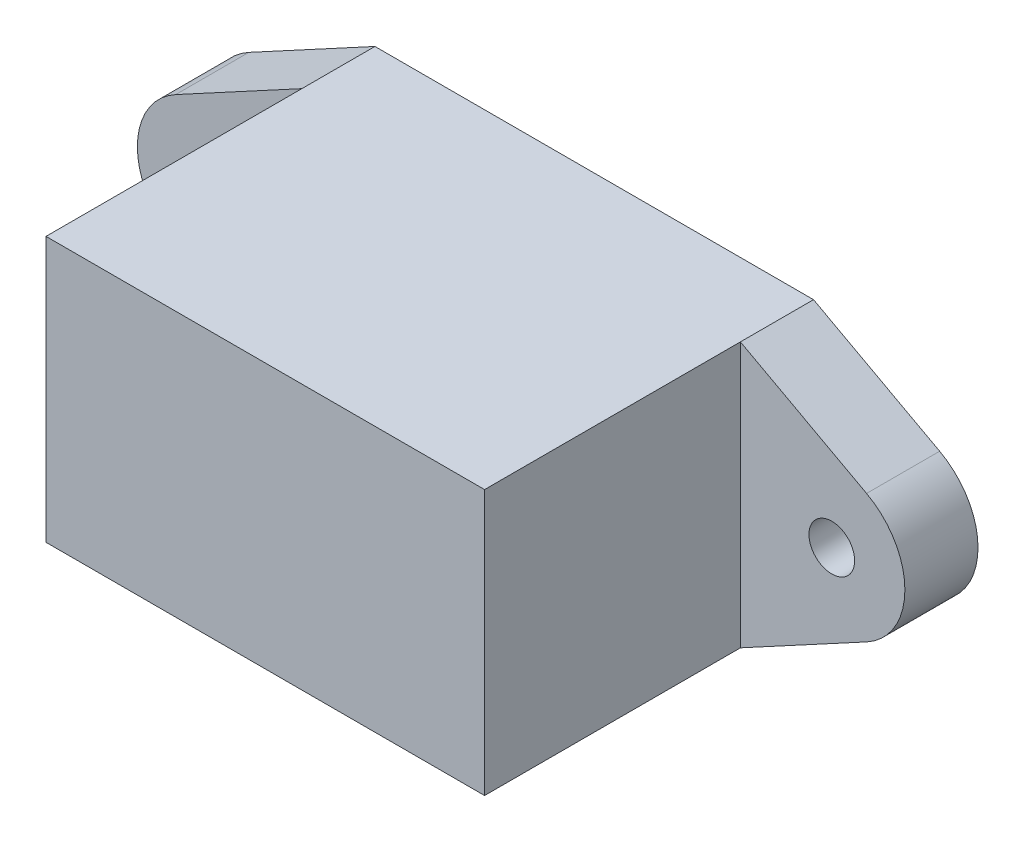
from build123d import *

# Parameters (mm, degrees)
SKETCH_1_W          = 24
SKETCH_1_H          = 14.5
EXTRUDE_1_DEPTH     = 18
SKETCH_2_R          = 1.25
EXTRUDE_2_DEPTH     = 4
EXTRUDE_2_2_DEPTH   = 4
CUT_EXTRUDE_1_DEPTH = 1.5


with BuildPart() as part:
    # Эскиз1 → Бобышка-Вытянуть1 (new body)
    with BuildSketch(Plane.XY):
        with Locations((-12, 7.25)):
            Rectangle(SKETCH_1_W, SKETCH_1_H)
    extrude(amount=EXTRUDE_1_DEPTH)

    # Эскиз3 → Вырез-Вытянуть1 (cut)
    with BuildSketch(Plane(origin=(0, 0, 0), x_dir=(-1, 0, 0), z_dir=(0, 0, -1))):
        Polygon((5, 7.25), (5, 10.75), (19, 10.75), (19, 3.75), (5, 3.75), align=None)
    extrude(amount=-CUT_EXTRUDE_1_DEPTH, mode=Mode.SUBTRACT)


with BuildPart() as body_2:
    # Эскиз2 → Бобышка-Вытянуть2 (new body)
    with BuildSketch(Plane(origin=(0, 0, 0), x_dir=(-1, 0, 0), z_dir=(0, 0, -1))):
        with BuildLine():
            Line((24, 14.5), (24, 0))
            Line((24, 0), (30.902196873, 3.731243536))
            ThreePointArc((30.902196873, 3.731243536), (33, 7.25), (30.902196873, 10.768756464))
            Line((30.902196873, 10.768756464), (24, 14.5))
        make_face()
        with Locations((29, 7.25)):
            Circle(SKETCH_2_R, mode=Mode.SUBTRACT)
    extrude(amount=-EXTRUDE_2_DEPTH)


with BuildPart() as body_3:
    # Эскиз2 → Extrude 2 2 (new body)
    with BuildSketch(Plane(origin=(0, 0, 0), x_dir=(-1, 0, 0), z_dir=(0, 0, -1))):
        with BuildLine():
            Line((0, 0), (-6.902196873, 3.731243536))
            ThreePointArc((-6.902196873, 3.731243536), (-9, 7.25), (-6.902196873, 10.768756464))
            Line((-6.902196873, 10.768756464), (0, 14.5))
            Line((0, 14.5), (0, 0))
        make_face()
        with Locations(Location((-5, 7.25, 0), (0, 0, 180))):
            Circle(SKETCH_2_R, mode=Mode.SUBTRACT)
    extrude(amount=-EXTRUDE_2_2_DEPTH)


solid = Compound([part.part, body_2.part, body_3.part])
